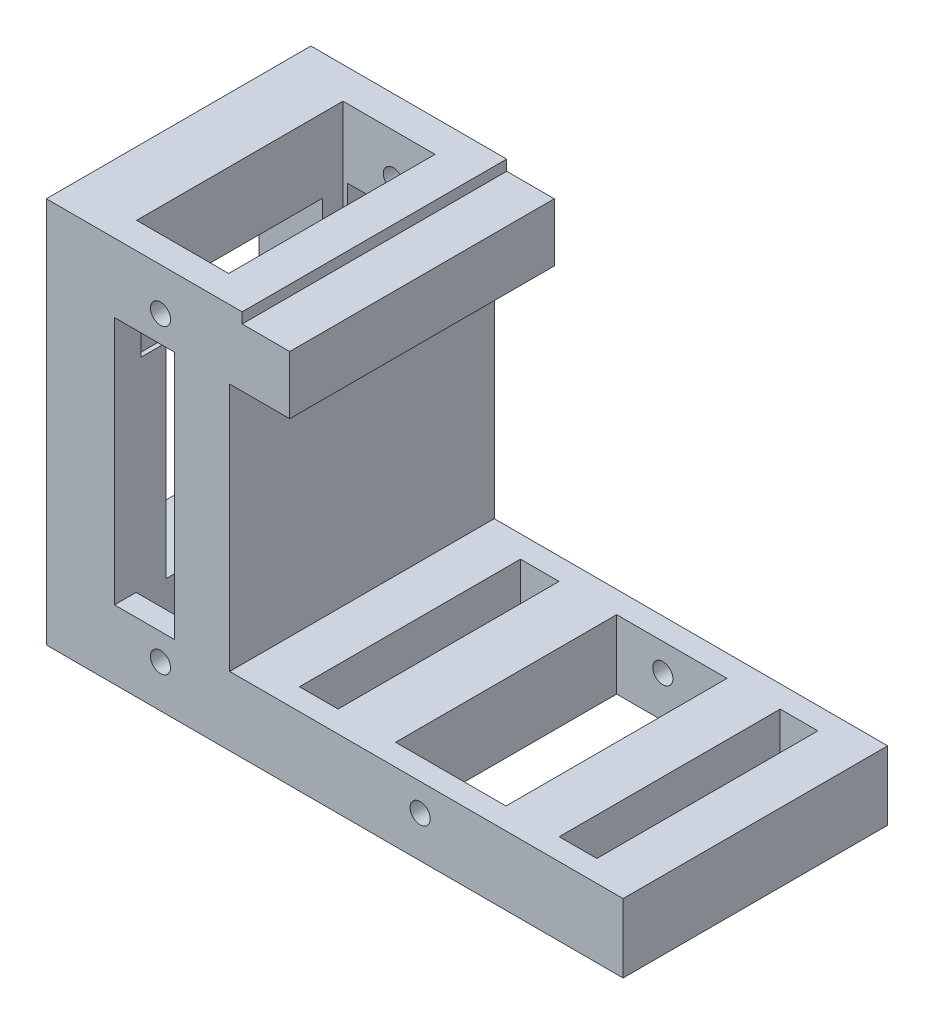
from build123d import *

# Parameters (mm, degrees)
SKETCH1_W           = 109
SKETCH1_H           = 50
BOSS_EXTRUDE1_DEPTH = 13
SKETCH2_W           = 20.172406269
SKETCH2_H           = 41.768023424
SKETCH2_W_2         = 20.8632421
SKETCH2_W_3         = 7.295226376
SKETCH2_W_4         = 7.129425777
CUT_EXTRUDE1_DEPTH  = 16
SKETCH4_W           = 12.874624242
SKETCH4_H           = 50
SKETCH4_W_2         = 10.390561779
BOSS_EXTRUDE2_DEPTH = 47.03
SKETCH5_W           = 50
SKETCH5_H           = 13
BOSS_EXTRUDE3_DEPTH = 46
SKETCH6_W           = 8.994074375
SKETCH6_H           = 50
CUT_EXTRUDE2_DEPTH  = 2
SKETCH7_W           = 17.404486576
SKETCH7_H           = 39
CUT_EXTRUDE3_DEPTH  = 22
SKETCH8_W           = 30.430427264
SKETCH8_H           = 46.659988472
CUT_EXTRUDE4_DEPTH  = 22
SKETCH9_R           = 1.9
CUT_EXTRUDE5_DEPTH  = 60


with BuildPart() as part:
    # Sketch1 → Boss-Extrude1 (new body)
    with BuildSketch(Plane(origin=(0, 0, 0), x_dir=(1, 0, 0), z_dir=(0, 1, 0))):
        with Locations((54.5, 25)):
            Rectangle(SKETCH1_W, SKETCH1_H)
    extrude(amount=BOSS_EXTRUDE1_DEPTH)

    # Sketch2 → Cut-Extrude1 (cut)
    with BuildSketch(Plane(origin=(0, 0, 0), x_dir=(-1, 0, 0), z_dir=(0, -1, 0))):
        with Locations((-22.960827377, 24.968248552)):
            Rectangle(SKETCH2_W, SKETCH2_H)
        with Locations((-72.355589302, 24.968248552)):
            Rectangle(SKETCH2_W_2, SKETCH2_H)
        with Locations((-47.402599082, 24.968248552)):
            Rectangle(SKETCH2_W_3, SKETCH2_H)
        with Locations((-96.396676226, 24.968248552)):
            Rectangle(SKETCH2_W_4, SKETCH2_H)
    extrude(amount=-CUT_EXTRUDE1_DEPTH, mode=Mode.SUBTRACT)

    # Sketch4 → Boss-Extrude2 (add)
    with BuildSketch(Plane(origin=(0, 13, 0), x_dir=(1, 0, 0), z_dir=(0, 1, 0))):
        with Locations((6.437312121, 25)):
            Rectangle(SKETCH4_W, SKETCH4_H)
        with Locations((29.461633581, 25)):
            Rectangle(SKETCH4_W_2, SKETCH4_H)
    extrude(amount=BOSS_EXTRUDE2_DEPTH)

    # Sketch5 → Boss-Extrude3 (add)
    with BuildSketch(Plane.ZY):
        with Locations((-25, 66.53)):
            Rectangle(SKETCH5_W, SKETCH5_H)
    extrude(amount=-BOSS_EXTRUDE3_DEPTH)

    # Sketch6 → Cut-Extrude2 (cut)
    with BuildSketch(Plane(origin=(0, 73.03, 0), x_dir=(1, 0, 0), z_dir=(0, 1, 0))):
        with Locations((41.502962813, 25)):
            Rectangle(SKETCH6_W, SKETCH6_H)
    extrude(amount=-CUT_EXTRUDE2_DEPTH, mode=Mode.SUBTRACT)

    # Sketch7 → Cut-Extrude3 (cut)
    with BuildSketch(Plane(origin=(0, 73.03, 0), x_dir=(1, 0, 0), z_dir=(0, 1, 0))):
        with Locations((20.762468631, 24.5)):
            Rectangle(SKETCH7_W, SKETCH7_H)
    extrude(amount=-CUT_EXTRUDE3_DEPTH, mode=Mode.SUBTRACT)

    # Sketch8 → Cut-Extrude4 (cut)
    with BuildSketch(Plane.ZY):
        with Locations((-24.949282621, 35.754239318)):
            Rectangle(SKETCH8_W, SKETCH8_H)
    extrude(amount=-CUT_EXTRUDE4_DEPTH, mode=Mode.SUBTRACT)

    # Sketch9 → Cut-Extrude5 (cut)
    with BuildSketch(Plane.XY):
        with Locations((21.57993313, 65.011863681)):
            Circle(SKETCH9_R)
        with Locations((21.57863067, 8.007764563)):
            Circle(SKETCH9_R)
        with Locations((70.65, 7.798014497)):
            Circle(SKETCH9_R)
    extrude(amount=-CUT_EXTRUDE5_DEPTH, mode=Mode.SUBTRACT)


solid = part.part
